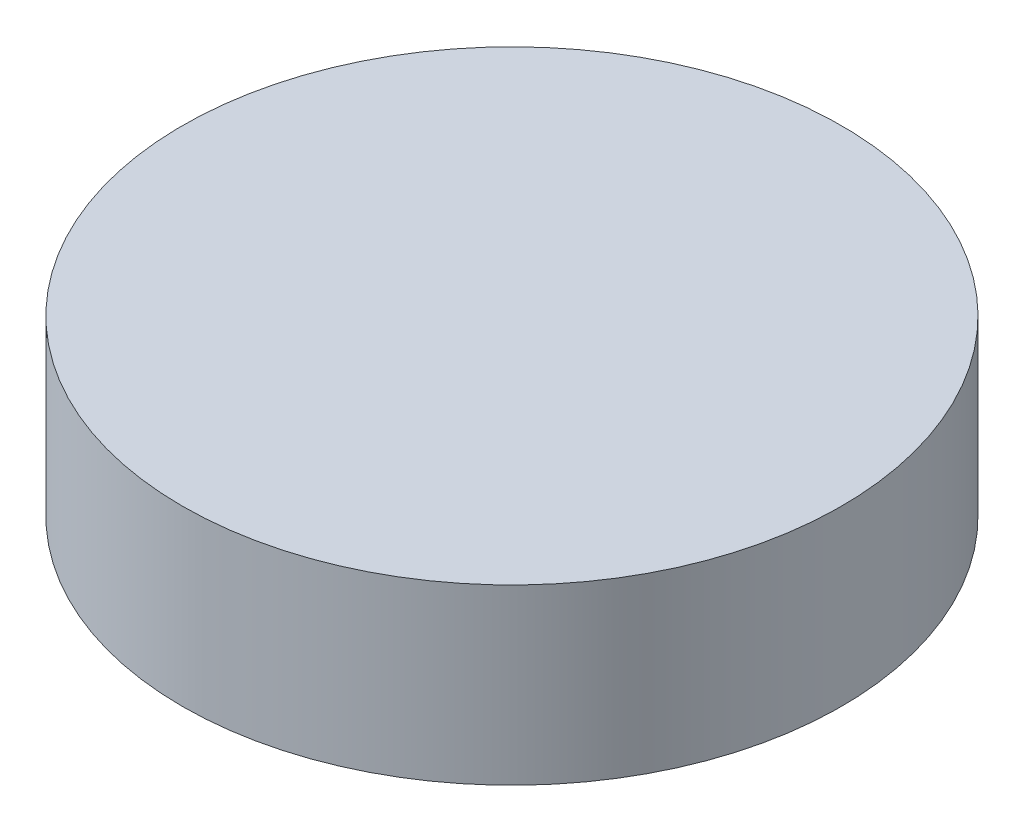
from build123d import *

# Parameters (mm, degrees)
SKETCH1_R           = 12.065
BOSS_EXTRUDE1_DEPTH = 6.35


with BuildPart() as part:
    # Sketch1 → Boss-Extrude1 (new body)
    with BuildSketch(Plane(origin=(0, 0, 0), x_dir=(1, 0, 0), z_dir=(0, 1, 0))):
        with Locations(Location((4.999655882, -4.961936119, 0), (0, 0, 270))):
            Circle(SKETCH1_R)
    extrude(amount=BOSS_EXTRUDE1_DEPTH)


solid = part.part
